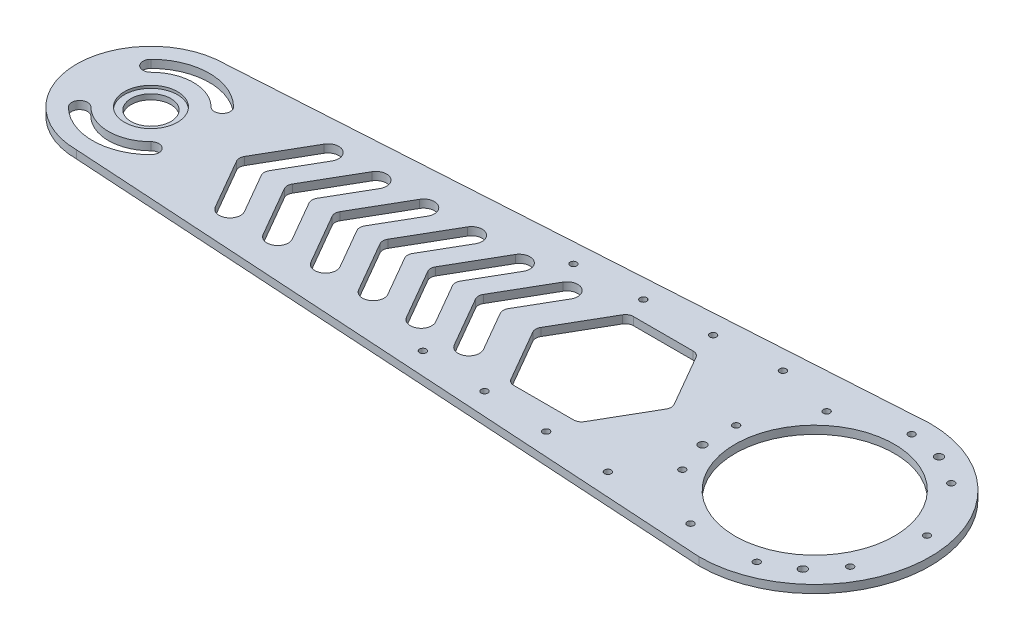
from build123d import *

# Parameters (mm, degrees)
EXTRUDE_1_DEPTH     = 3
SKETCH_3_R          = 1.25
SKETCH_3_R_2        = 30
SKETCH_3_R_3        = 1.5
CUT_EXTRUDE_1_DEPTH = 3
CUT_EXTRUDE_2_DEPTH = 3
SKETCH_5_R          = 1.25
CUT_EXTRUDE_3_DEPTH = 10
SKETCH_6_R          = 10
CUT_EXTRUDE_4_DEPTH = 1
SKETCH_7_R          = 7.5
CUT_EXTRUDE_5_DEPTH = 11


with BuildPart() as part:
    # 草图2 → 凸台-拉伸1 (new body)
    with BuildSketch(Plane(origin=(0, 5, 0), x_dir=(1, 0, 0), z_dir=(0, 1, 0))):
        with BuildLine():
            Line((-250, 28), (0, 43.5))
            ThreePointArc((0, 43.5), (43.5, 0), (0, -43.5))
            Line((0, -43.5), (-250, -28))
            ThreePointArc((-250, -28), (-278, 0), (-250, 28))
        make_face()
    extrude(amount=EXTRUDE_1_DEPTH)

    # 草图3 → 切除-拉伸1 (cut)
    with BuildSketch(Plane(origin=(0, 8, 0), x_dir=(1, 0, 0), z_dir=(0, 1, 0))):
        with Locations(Location((-250, 4, 0), (0, 0, 270))):
            Circle(SKETCH_3_R)
        with Locations(Location((-246, 0, 0), (0, 0, 270))):
            Circle(SKETCH_3_R)
        with Locations(Location((-250, -4, 0), (0, 0, 270))):
            Circle(SKETCH_3_R)
        with Locations(Location((-254, 0, 0), (0, 0, 270))):
            Circle(SKETCH_3_R)
        with Locations(Location((0, 0, 0), (0, 0, 270))):
            Circle(SKETCH_3_R_2)
        with Locations(Location((0, 36.5, 0), (0, 0, 270))):
            Circle(SKETCH_3_R)
        with Locations(Location((12.483735231, 34.298780659, 0), (0, 0, 270))):
            Circle(SKETCH_3_R_3)
        with Locations(Location((23.461747754, 27.960622174, 0), (0, 0, 270))):
            Circle(SKETCH_3_R)
        with Locations(Location((-23.461747754, 27.960622174, 0), (0, 0, 270))):
            Circle(SKETCH_3_R)
        with Locations(Location((-35.945482985, 6.338158485, 0), (0, 0, 270))):
            Circle(SKETCH_3_R)
        with Locations(Location((-35.945482985, -6.338158485, 0), (0, 0, 270))):
            Circle(SKETCH_3_R_3)
        with Locations(Location((-31.609927238, -18.25, 0), (0, 0, 270))):
            Circle(SKETCH_3_R)
        with Locations(Location((-12.483735231, -34.298780659, 0), (0, 0, 270))):
            Circle(SKETCH_3_R)
        with Locations(Location((12.483735231, -34.298780659, 0), (0, 0, 270))):
            Circle(SKETCH_3_R)
        with Locations(Location((23.461747754, -27.960622174, 0), (0, 0, 270))):
            Circle(SKETCH_3_R_3)
        with Locations(Location((31.609927238, -18.25, 0), (0, 0, 270))):
            Circle(SKETCH_3_R)
        with Locations(Location((35.945482985, 6.338158485, 0), (0, 0, 270))):
            Circle(SKETCH_3_R)
        with BuildLine():
            ThreePointArc((-265.553651429, 15.553651429), (-265.553651429, 11.316406256), (-261.316406256, 11.316406256))
            ThreePointArc((-261.316406256, 11.316406256), (-250, 16.003815204), (-238.683593744, 11.316406256))
            ThreePointArc((-238.683593744, 11.316406256), (-234.446348571, 11.316406256), (-234.446348571, 15.553651429))
            ThreePointArc((-234.446348571, 15.553651429), (-250, 21.996184796), (-265.553651429, 15.553651429))
        make_face()
        with BuildLine():
            ThreePointArc((-261.316406256, -11.316406256), (-250, -16.003815204), (-238.683593744, -11.316406256))
            ThreePointArc((-238.683593744, -11.316406256), (-234.446348571, -11.316406256), (-234.446348571, -15.553651429))
            ThreePointArc((-234.446348571, -15.553651429), (-250, -21.996184796), (-265.553651429, -15.553651429))
            ThreePointArc((-265.553651429, -15.553651429), (-265.553651429, -11.316406256), (-261.316406256, -11.316406256))
        make_face()
    extrude(amount=-CUT_EXTRUDE_1_DEPTH, mode=Mode.SUBTRACT)

    # 草图4 → 切除-拉伸2 (cut)
    with BuildSketch(Plane(origin=(0, 8, 0), x_dir=(1, 0, 0), z_dir=(0, 1, 0))):
        with BuildLine():
            Line((-216.23889617, 1.5), (-205.267472927, 20.503062488))
            ThreePointArc((-205.267472927, 20.503062488), (-199.762485666, 21.978119379), (-198.287428775, 16.473132117))
            Line((-198.287428775, 16.473132117), (-206.932170633, 1.5))
            ThreePointArc((-206.932170633, 1.5), (-207.334094422, 0), (-206.932170633, -1.5))
            Line((-206.932170633, -1.5), (-198.287428775, -16.473132117))
            ThreePointArc((-198.287428775, -16.473132117), (-199.762485666, -21.978119379), (-205.267472927, -20.503062488))
            Line((-205.267472927, -20.503062488), (-216.23889617, -1.5))
            ThreePointArc((-216.23889617, -1.5), (-216.640819958, 0), (-216.23889617, 1.5))
        make_face()
        with BuildLine():
            Line((-54.444025551, 1.5), (-65.7023558, 21))
            ThreePointArc((-65.7023558, 21), (-66.800432012, 22.098076211), (-68.300432012, 22.5))
            Line((-68.300432012, 22.5), (-90.81709251, 22.5))
            ThreePointArc((-90.81709251, 22.5), (-92.31709251, 22.098076211), (-93.415168722, 21))
            Line((-93.415168722, 21), (-104.673498971, 1.5))
            ThreePointArc((-104.673498971, 1.5), (-105.075422759, 0), (-104.673498971, -1.5))
            Line((-104.673498971, -1.5), (-93.415168722, -21))
            ThreePointArc((-93.415168722, -21), (-92.31709251, -22.098076211), (-90.81709251, -22.5))
            Line((-90.81709251, -22.5), (-68.300432012, -22.5))
            ThreePointArc((-68.300432012, -22.5), (-66.800432012, -22.098076211), (-65.7023558, -21))
            Line((-65.7023558, -21), (-54.444025551, -1.5))
            ThreePointArc((-54.444025551, -1.5), (-54.042101763, 0), (-54.444025551, 1.5))
        make_face()
        with BuildLine():
            Line((-188.932170633, -1.5), (-180.287428775, -16.473132117))
            ThreePointArc((-180.287428775, -16.473132117), (-181.762485666, -21.978119379), (-187.267472927, -20.503062488))
            Line((-187.267472927, -20.503062488), (-198.23889617, -1.5))
            ThreePointArc((-198.23889617, -1.5), (-198.640819958, 0), (-198.23889617, 1.5))
            Line((-198.23889617, 1.5), (-187.267472927, 20.503062488))
            ThreePointArc((-187.267472927, 20.503062488), (-181.762485666, 21.978119379), (-180.287428775, 16.473132117))
            Line((-180.287428775, 16.473132117), (-188.932170633, 1.5))
            ThreePointArc((-188.932170633, 1.5), (-189.334094422, 0), (-188.932170633, -1.5))
        make_face()
        with BuildLine():
            Line((-170.932170633, -1.5), (-162.287428775, -16.473132117))
            ThreePointArc((-162.287428775, -16.473132117), (-163.762485666, -21.978119379), (-169.267472927, -20.503062488))
            Line((-169.267472927, -20.503062488), (-180.23889617, -1.5))
            ThreePointArc((-180.23889617, -1.5), (-180.640819958, 0), (-180.23889617, 1.5))
            Line((-180.23889617, 1.5), (-169.267472927, 20.503062488))
            ThreePointArc((-169.267472927, 20.503062488), (-163.762485666, 21.978119379), (-162.287428775, 16.473132117))
            Line((-162.287428775, 16.473132117), (-170.932170633, 1.5))
            ThreePointArc((-170.932170633, 1.5), (-171.334094422, 0), (-170.932170633, -1.5))
        make_face()
        with BuildLine():
            Line((-152.932170633, -1.5), (-144.287428775, -16.473132117))
            ThreePointArc((-144.287428775, -16.473132117), (-145.762485666, -21.978119379), (-151.267472927, -20.503062488))
            Line((-151.267472927, -20.503062488), (-162.23889617, -1.5))
            ThreePointArc((-162.23889617, -1.5), (-162.640819958, 0), (-162.23889617, 1.5))
            Line((-162.23889617, 1.5), (-151.267472927, 20.503062488))
            ThreePointArc((-151.267472927, 20.503062488), (-145.762485666, 21.978119379), (-144.287428775, 16.473132117))
            Line((-144.287428775, 16.473132117), (-152.932170633, 1.5))
            ThreePointArc((-152.932170633, 1.5), (-153.334094422, 0), (-152.932170633, -1.5))
        make_face()
        with BuildLine():
            Line((-134.932170633, -1.5), (-126.287428775, -16.473132117))
            ThreePointArc((-126.287428775, -16.473132117), (-127.762485666, -21.978119379), (-133.267472927, -20.503062488))
            Line((-133.267472927, -20.503062488), (-144.23889617, -1.5))
            ThreePointArc((-144.23889617, -1.5), (-144.640819958, 0), (-144.23889617, 1.5))
            Line((-144.23889617, 1.5), (-133.267472927, 20.503062488))
            ThreePointArc((-133.267472927, 20.503062488), (-127.762485666, 21.978119379), (-126.287428775, 16.473132117))
            Line((-126.287428775, 16.473132117), (-134.932170633, 1.5))
            ThreePointArc((-134.932170633, 1.5), (-135.334094422, 0), (-134.932170633, -1.5))
        make_face()
        with BuildLine():
            Line((-116.932170633, -1.5), (-108.287428775, -16.473132117))
            ThreePointArc((-108.287428775, -16.473132117), (-109.762485666, -21.978119379), (-115.267472927, -20.503062488))
            Line((-115.267472927, -20.503062488), (-126.23889617, -1.5))
            ThreePointArc((-126.23889617, -1.5), (-126.640819958, 0), (-126.23889617, 1.5))
            Line((-126.23889617, 1.5), (-115.267472927, 20.503062488))
            ThreePointArc((-115.267472927, 20.503062488), (-109.762485666, 21.978119379), (-108.287428775, 16.473132117))
            Line((-108.287428775, 16.473132117), (-116.932170633, 1.5))
            ThreePointArc((-116.932170633, 1.5), (-117.334094422, 0), (-116.932170633, -1.5))
        make_face()
    extrude(amount=-CUT_EXTRUDE_2_DEPTH, mode=Mode.SUBTRACT)

    # 草图5 → 切除-拉伸3 (cut)
    with BuildSketch(Plane(origin=(0, 8, 0), x_dir=(1, 0, 0), z_dir=(0, 1, 0))):
        with Locations(Location((-44.941689831, 32.96361523, 0), (0, 0, 270))):
            Circle(SKETCH_5_R)
        with Locations(Location((-69.702891128, 31.42842075, 0), (0, 0, 270))):
            Circle(SKETCH_5_R)
        with Locations(Location((-119.225293723, 28.358031789, 0), (0, 0, 270))):
            Circle(SKETCH_5_R)
        with Locations(Location((-94.464092426, 29.89322627, 0), (0, 0, 270))):
            Circle(SKETCH_5_R)
        with Locations(Location((-44.941689831, -32.96361523, 0), (0, 0, 270))):
            Circle(SKETCH_5_R)
        with Locations(Location((-69.702891128, -31.42842075, 0), (0, 0, 270))):
            Circle(SKETCH_5_R)
        with Locations(Location((-94.464092426, -29.89322627, 0), (0, 0, 270))):
            Circle(SKETCH_5_R)
        with Locations(Location((-119.225293723, -28.358031789, 0), (0, 0, 270))):
            Circle(SKETCH_5_R)
    extrude(amount=-CUT_EXTRUDE_3_DEPTH, mode=Mode.SUBTRACT)

    # 草图6 → 切除-拉伸4 (cut)
    with BuildSketch(Plane(origin=(0, 8, 0), x_dir=(1, 0, 0), z_dir=(0, 1, 0))):
        with Locations(Location((-250, 0, 0), (0, 0, 270))):
            Circle(SKETCH_6_R)
    extrude(amount=-CUT_EXTRUDE_4_DEPTH, mode=Mode.SUBTRACT)

    # 草图7 → 切除-拉伸5 (cut)
    with BuildSketch(Plane(origin=(0, 7, 0), x_dir=(1, 0, 0), z_dir=(0, 1, 0))):
        with Locations(Location((-250, 0, 0), (0, 0, 270))):
            Circle(SKETCH_7_R)
    extrude(amount=-CUT_EXTRUDE_5_DEPTH, mode=Mode.SUBTRACT)


solid = part.part
